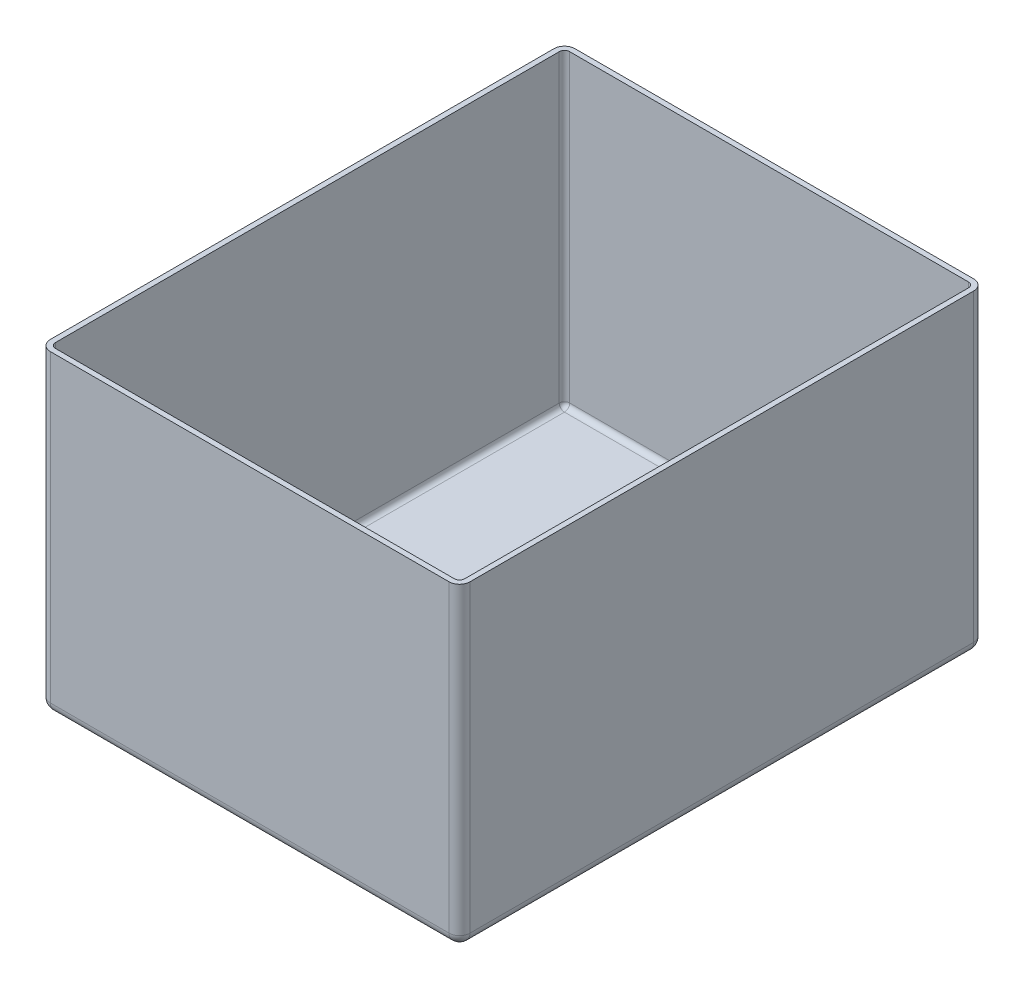
from build123d import *

# Parameters (mm, degrees)
CROQUIS1_W     = 400
CROQUIS1_H     = 500
EXTRUIR1_DEPTH = 300
REDONDEO1_R    = 10
VACIADO1_T     = -5


with BuildPart() as part:
    # Croquis1 → Extruir1 (new body)
    with BuildSketch(Plane(origin=(0, 0, 0), x_dir=(1, 0, 0), z_dir=(0, 1, 0))):
        Rectangle(CROQUIS1_W, CROQUIS1_H)
    extrude(amount=EXTRUIR1_DEPTH)

    # Redondeo1
    redondeo1_edges = [part.edges().sort_by_distance(p)[0] for p in [
        (0, 0, -250),
        (200, 0, 0),
        (0, 0, 250),
        (-200, 0, 0),
        (-200, 150, -250),
        (200, 150, -250),
        (200, 150, 250),
        (-200, 150, 250),
    ]]
    fillet(redondeo1_edges, radius=REDONDEO1_R)

    # Vaciado1
    vaciado1_openings = [part.faces().sort_by_distance(p)[0] for p in [
        (0, 300, 0),
    ]]
    offset(amount=VACIADO1_T, openings=vaciado1_openings, kind=Kind.INTERSECTION)


solid = part.part
